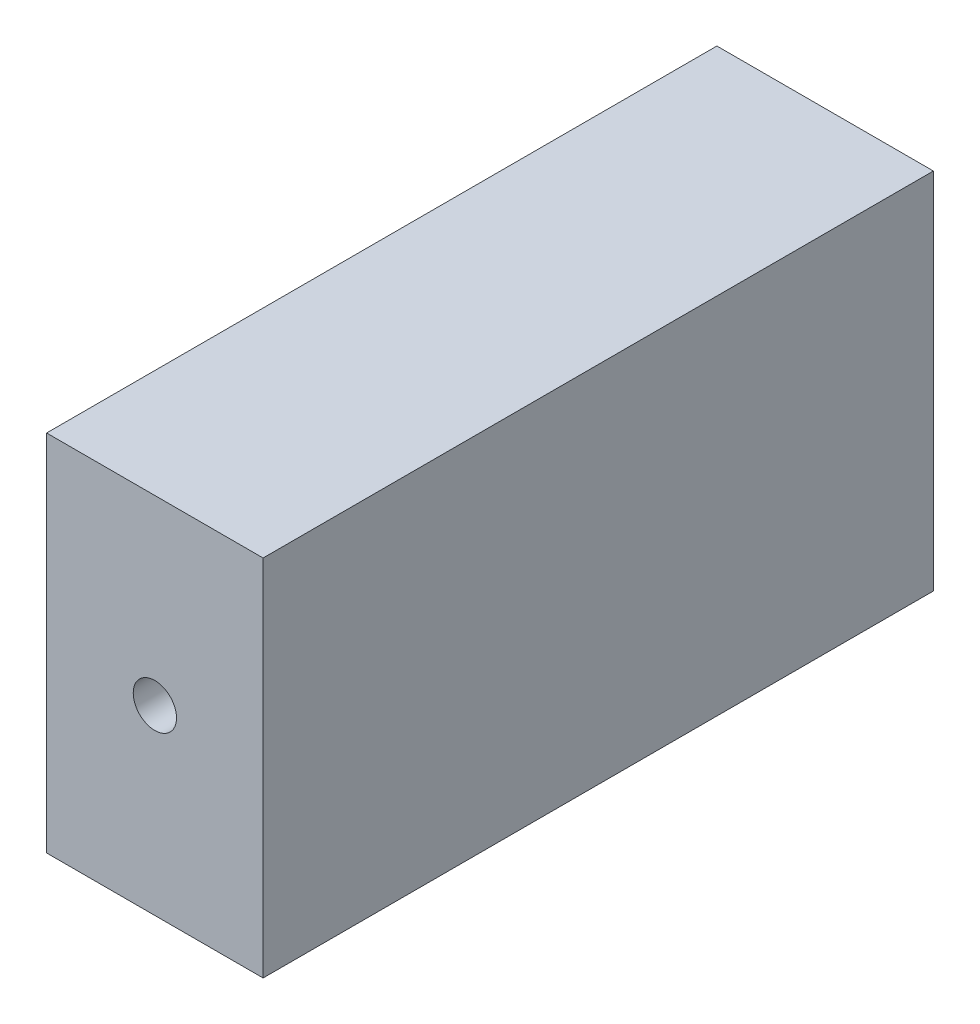
from build123d import *

# Parameters (mm, degrees)
SKETCH1_W            = 157.271841604
SKETCH1_H            = 85.34874331
BOSS_EXTRUDE1_DEPTH  = 25.4
CUT_SWEEP2_PROFILE_R = 5.08


with BuildPart() as part:
    # Sketch1 → Boss-Extrude1 (new, symmetric)
    with BuildSketch(Plane(origin=(0, 0, 0), x_dir=(0, 0, -1), z_dir=(1, 0, 0))):
        Rectangle(SKETCH1_W, SKETCH1_H)
    extrude(amount=BOSS_EXTRUDE1_DEPTH, both=True)

    # Cut-Sweep2: sweep along a path in Sketch11
    with BuildLine(Plane(origin=(0, 0, 0), x_dir=(0, 0, -1), z_dir=(1, 0, 0))) as cut_sweep2_path:
        Line((-86.885944584, 0), (-36.013867587, 0))
        Line((-36.013867587, 0), (-23.506619997, 28.372870033))
        Line((-23.506619997, 28.372870033), (26.452653889, 28.372870033))
        Line((26.452653889, 28.372870033), (46.242947448, 0))
        Line((46.242947448, 0), (78.869898607, 0))
    # Cut-Sweep2 profile (on start of the path) → Cut-Sweep2 (sweep, cut)
    with BuildSketch(Plane(origin=(0, 0, 86.885944584), x_dir=(-1, 0, 0), z_dir=(0, 0, -1))):
        Circle(CUT_SWEEP2_PROFILE_R)
    sweep(path=cut_sweep2_path.line, transition=Transition.RIGHT, mode=Mode.SUBTRACT)


solid = part.part
